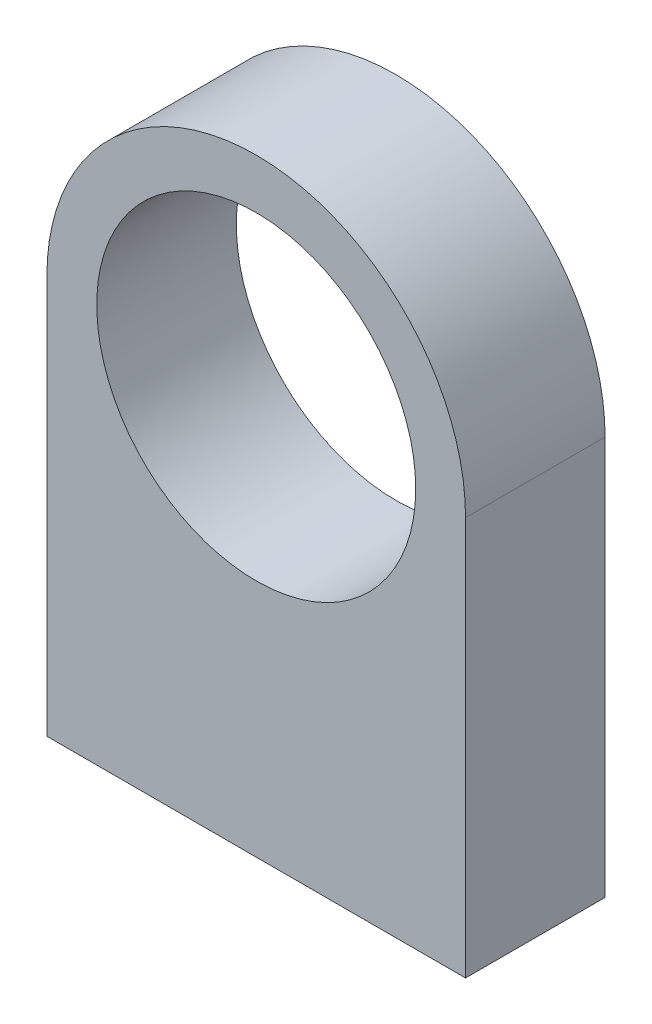
from build123d import *

# Parameters (mm, degrees)
SALIENTE_EXTRUIR1_DEPTH = 3.5
CROQUIS2_R              = 8
CORTAR_EXTRUIR1_DEPTH   = 25.072806234


with BuildPart() as part:
    # Croquis1 → Saliente-Extruir1 (new, symmetric)
    with BuildSketch(Plane.XY):
        with BuildLine():
            Line((10.5, -10), (-10.5, -10))
            Line((-10.5, -10), (-10.5, 10))
            ThreePointArc((-10.5, 10), (0, 20.5), (10.5, 10))
            Line((10.5, 10), (10.5, -10))
        make_face()
    extrude(amount=SALIENTE_EXTRUIR1_DEPTH, both=True)

    # Croquis2 → Cortar-Extruir1 (cut, through all)
    with BuildSketch(Plane.XY.offset(3.5)):
        with Locations((0, 10)):
            Circle(CROQUIS2_R)
    extrude(amount=-CORTAR_EXTRUIR1_DEPTH, mode=Mode.SUBTRACT)


solid = part.part
